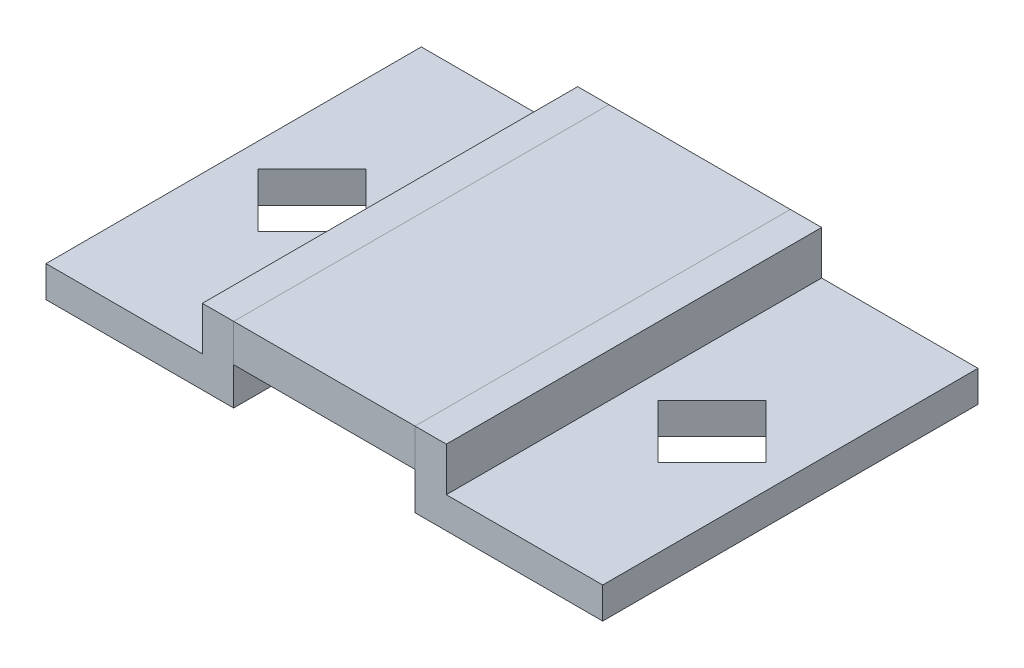
from build123d import *

# Parameters (mm, degrees)
SKETCH1_W             = 14.5
SKETCH1_H             = 30
BOSS_EXTRUDE1_DEPTH   = 3
SKETCH2_W             = 2.5
SKETCH2_H             = 30
BOSS_EXTRUDE2_DEPTH   = 6
BOSS_EXTRUDE2_2_DEPTH = 6
SKETCH3_W             = 12.5
SKETCH3_H             = 30
BOSS_EXTRUDE3_DEPTH   = 2.5
CUT_EXTRUDE2_DEPTH    = 43.219663665


with BuildPart() as part:
    # Sketch1 → Boss-Extrude1 (new body)
    with BuildSketch(Plane(origin=(0, 0, 0), x_dir=(1, 0, 0), z_dir=(0, 1, 0))):
        with Locations((7.25, 15)):
            Rectangle(SKETCH1_W, SKETCH1_H)
    extrude(amount=BOSS_EXTRUDE1_DEPTH)


with BuildPart() as body_2:
    # Sketch2 → Boss-Extrude2 (new body)
    with BuildSketch(Plane(origin=(0, 3, 0), x_dir=(1, 0, 0), z_dir=(0, 1, 0))):
        with Locations((-1.25, 15)):
            Rectangle(SKETCH2_W, SKETCH2_H)
    extrude(amount=-BOSS_EXTRUDE2_DEPTH)



with BuildPart() as body_3:
    # Sketch2 → Boss-Extrude2 2 (new body)
    with BuildSketch(Plane(origin=(0, 3, 0), x_dir=(1, 0, 0), z_dir=(0, 1, 0))):
        with Locations((15.75, 15)):
            Rectangle(SKETCH2_W, SKETCH2_H)
    extrude(amount=-BOSS_EXTRUDE2_2_DEPTH)


with BuildPart() as body_2_1:
    add(body_2.part)

    add(body_3.part)  # Boss-Extrude3 merges body 3
    # Sketch3 → Boss-Extrude3 (add)
    with BuildSketch(Plane.XZ.offset(3)):
        with Locations((-8.75, -15)):
            Rectangle(SKETCH3_W, SKETCH3_H)
        with Locations((23.25, -15)):
            Rectangle(SKETCH3_W, SKETCH3_H)
    extrude(amount=-BOSS_EXTRUDE3_DEPTH)

    # Sketch4 → Cut-Extrude2 (cut, through all)
    with BuildSketch(Plane(origin=(0, -0.5, 0), x_dir=(1, 0, 0), z_dir=(0, 1, 0))):
        Polygon((-8.75, 19.313351365), (-13.063351365, 15), (-8.75, 10.686648635), (-4.436648635, 15), align=None)
        Polygon((23.25, 10.686648635), (18.936648635, 15), (23.25, 19.313351365), (27.563351365, 15), align=None)
    extrude(amount=-CUT_EXTRUDE2_DEPTH, mode=Mode.SUBTRACT)


solid = Compound([part.part, body_2_1.part])
